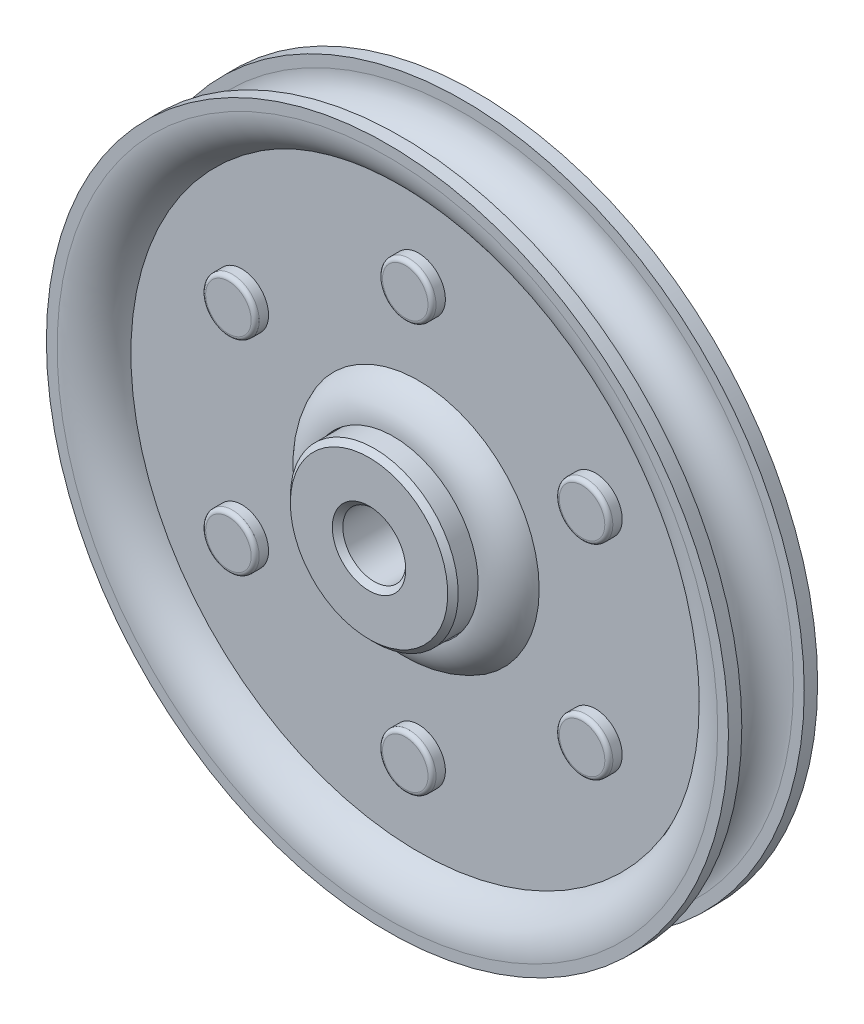
from build123d import *

# Parameters (mm, degrees)
CIRPATTERN1_COUNT = 20
CHAMFER1_SIZE     = 0.79375
FILLET1_R         = 0.60721875
CIRPATTERN2_COUNT = 6
CIRPATTERN3_COUNT = 6


with BuildPart() as part:
    # Sketch1 → Revolve1 (revolve)
    with BuildSketch(Plane(origin=(0, 0, 0), x_dir=(0, 0, -1), z_dir=(1, 0, 0))):
        with BuildLine():
            Line((4.7228125, 51.59375), (6.746875, 51.59375))
            Line((6.746875, 51.59375), (6.746875, 49.9665625))
            ThreePointArc((6.746875, 49.9665625), (5.439504525, 45.975057421), (2.0240625, 43.53045395))
            Line((2.0240625, 43.53045395), (2.0240625, 18.244026183))
            ThreePointArc((2.0240625, 18.244026183), (4.775434847, 16.12924186), (5.842, 12.827))
            Line((5.842, 12.827), (1.98335874, 12.827))
            ThreePointArc((1.98335874, 12.827), (0, 14.747875), (-1.98335874, 12.827))
            Line((-1.98335874, 12.827), (-5.842, 12.827))
            ThreePointArc((-5.842, 12.827), (-4.775434847, 16.12924186), (-2.0240625, 18.244026183))
            Line((-2.0240625, 18.244026183), (-2.0240625, 43.53045395))
            ThreePointArc((-2.0240625, 43.53045395), (-5.439504525, 45.975057421), (-6.746875, 49.9665625))
            Line((-6.746875, 49.9665625), (-6.746875, 51.59375))
            Line((-6.746875, 51.59375), (-4.7228125, 51.59375))
            Line((-4.7228125, 51.59375), (-4.7228125, 49.9665625))
            ThreePointArc((-4.7228125, 49.9665625), (0, 45.24375), (4.7228125, 49.9665625))
            Line((4.7228125, 49.9665625), (4.7228125, 51.59375))
        make_face()
        with BuildLine():
            Line((9.525, 4.7625), (-9.525, 4.7625))
            Line((-9.525, 4.7625), (-9.525, 12.7))
            Line((-9.525, 12.7), (-1.98335874, 12.7))
            ThreePointArc((-1.98335874, 12.7), (0, 10.779125), (1.98335874, 12.7))
            Line((1.98335874, 12.7), (9.525, 12.7))
            Line((9.525, 12.7), (9.525, 4.7625))
        make_face()
    revolve(axis=Axis((0, 0, 9.525), (0, 0, -1)))

    # Chamfer1
    chamfer1_edges = [part.edges().sort_by_distance(p)[0] for p in [
        (0, -4.7625, -9.525),
        (0, -12.7, -9.525),
        (0, -12.7, 9.525),
        (0, -4.7625, 9.525),
    ]]
    chamfer(chamfer1_edges, length=CHAMFER1_SIZE)

    # Sketch4 → Cut-Revolve2 (revolve, cut)
    with BuildSketch(Plane(origin=(0, 0, 0), x_dir=(0, 0, -1), z_dir=(1, 0, 0))):
        Polygon((-2.0240625, 32.911302567), (2.0240625, 32.911302567), (2.0240625, 34.935365067), (4.048125, 34.935365067), (4.048125, 30.887240067), (-4.048125, 30.887240067), (-4.048125, 34.935365067), (-2.0240625, 34.935365067), align=None)
    cut_revolve2 = revolve(axis=Axis((0, 30.887240067, 4.048125), (0, 0, -1)), mode=Mode.SUBTRACT)

    # CirPattern2: Cut-Revolve2 ×6 about axis
    cirpattern2_axis = Axis((0, 0, 0), (0, 0, -1))
    for i in range(1, CIRPATTERN2_COUNT):
        add(cut_revolve2.rotate(cirpattern2_axis, i * 360 / CIRPATTERN2_COUNT), mode=Mode.SUBTRACT)


with BuildPart() as body_2:
    # Sketch2 → Revolve2 (revolve)
    with BuildSketch(Plane(origin=(0, 0, 0), x_dir=(0, 0, -1), z_dir=(1, 0, 0))):
        with BuildLine():
            Line((0, 14.747875), (0, 10.779125))
            ThreePointArc((0, 10.779125), (1.984375, 12.7635), (0, 14.747875))
        make_face()
    revolve(axis=Axis((0, 14.747875, 0), (0, -1, 0)))


with BuildPart() as cirpattern1_1:
    # CirPattern1: pattern copy
    add(body_2.part.rotate(Axis((0, 0, 0), (0, 0, -1)), 1 * 360 / CIRPATTERN1_COUNT))


with BuildPart() as cirpattern1_2:
    # CirPattern1: pattern copy
    add(body_2.part.rotate(Axis((0, 0, 0), (0, 0, -1)), 2 * 360 / CIRPATTERN1_COUNT))


with BuildPart() as cirpattern1_3:
    # CirPattern1: pattern copy
    add(body_2.part.rotate(Axis((0, 0, 0), (0, 0, -1)), 3 * 360 / CIRPATTERN1_COUNT))


with BuildPart() as cirpattern1_4:
    # CirPattern1: pattern copy
    add(body_2.part.rotate(Axis((0, 0, 0), (0, 0, -1)), 4 * 360 / CIRPATTERN1_COUNT))


with BuildPart() as cirpattern1_5:
    # CirPattern1: pattern copy
    add(body_2.part.rotate(Axis((0, 0, 0), (0, 0, -1)), 5 * 360 / CIRPATTERN1_COUNT))


with BuildPart() as cirpattern1_6:
    # CirPattern1: pattern copy
    add(body_2.part.rotate(Axis((0, 0, 0), (0, 0, -1)), 6 * 360 / CIRPATTERN1_COUNT))


with BuildPart() as cirpattern1_7:
    # CirPattern1: pattern copy
    add(body_2.part.rotate(Axis((0, 0, 0), (0, 0, -1)), 7 * 360 / CIRPATTERN1_COUNT))


with BuildPart() as cirpattern1_8:
    # CirPattern1: pattern copy
    add(body_2.part.rotate(Axis((0, 0, 0), (0, 0, -1)), 8 * 360 / CIRPATTERN1_COUNT))


with BuildPart() as cirpattern1_9:
    # CirPattern1: pattern copy
    add(body_2.part.rotate(Axis((0, 0, 0), (0, 0, -1)), 9 * 360 / CIRPATTERN1_COUNT))


with BuildPart() as cirpattern1_10:
    # CirPattern1: pattern copy
    add(body_2.part.rotate(Axis((0, 0, 0), (0, 0, -1)), 10 * 360 / CIRPATTERN1_COUNT))


with BuildPart() as cirpattern1_11:
    # CirPattern1: pattern copy
    add(body_2.part.rotate(Axis((0, 0, 0), (0, 0, -1)), 11 * 360 / CIRPATTERN1_COUNT))


with BuildPart() as cirpattern1_12:
    # CirPattern1: pattern copy
    add(body_2.part.rotate(Axis((0, 0, 0), (0, 0, -1)), 12 * 360 / CIRPATTERN1_COUNT))


with BuildPart() as cirpattern1_13:
    # CirPattern1: pattern copy
    add(body_2.part.rotate(Axis((0, 0, 0), (0, 0, -1)), 13 * 360 / CIRPATTERN1_COUNT))


with BuildPart() as cirpattern1_14:
    # CirPattern1: pattern copy
    add(body_2.part.rotate(Axis((0, 0, 0), (0, 0, -1)), 14 * 360 / CIRPATTERN1_COUNT))


with BuildPart() as cirpattern1_15:
    # CirPattern1: pattern copy
    add(body_2.part.rotate(Axis((0, 0, 0), (0, 0, -1)), 15 * 360 / CIRPATTERN1_COUNT))


with BuildPart() as cirpattern1_16:
    # CirPattern1: pattern copy
    add(body_2.part.rotate(Axis((0, 0, 0), (0, 0, -1)), 16 * 360 / CIRPATTERN1_COUNT))


with BuildPart() as cirpattern1_17:
    # CirPattern1: pattern copy
    add(body_2.part.rotate(Axis((0, 0, 0), (0, 0, -1)), 17 * 360 / CIRPATTERN1_COUNT))


with BuildPart() as cirpattern1_18:
    # CirPattern1: pattern copy
    add(body_2.part.rotate(Axis((0, 0, 0), (0, 0, -1)), 18 * 360 / CIRPATTERN1_COUNT))


with BuildPart() as cirpattern1_19:
    # CirPattern1: pattern copy
    add(body_2.part.rotate(Axis((0, 0, 0), (0, 0, -1)), 19 * 360 / CIRPATTERN1_COUNT))


with BuildPart() as body_22:
    # Sketch4<2> → Revolve3 (revolve)
    with BuildSketch(Plane(origin=(0, 0, 0), x_dir=(0, 0, -1), z_dir=(1, 0, 0))):
        Polygon((-2.0240625, 32.911302567), (2.0240625, 32.911302567), (2.0240625, 34.935365067), (4.048125, 34.935365067), (4.048125, 30.887240067), (-4.048125, 30.887240067), (-4.048125, 34.935365067), (-2.0240625, 34.935365067), align=None)
    revolve(axis=Axis((0, 30.887240067, 4.048125), (0, 0, -1)))

    # Fillet1
    fillet1_edges = [body_22.edges().sort_by_distance(p)[0] for p in [
        (0, 26.839115067, -4.048125),
        (0, 26.839115067, 4.048125),
    ]]
    fillet(fillet1_edges, radius=FILLET1_R)


with BuildPart() as cirpattern3_1:
    # CirPattern3: pattern copy
    add(body_22.part.rotate(Axis((0, 0, 0), (0, 0, -1)), 1 * 360 / CIRPATTERN3_COUNT))


with BuildPart() as cirpattern3_2:
    # CirPattern3: pattern copy
    add(body_22.part.rotate(Axis((0, 0, 0), (0, 0, -1)), 2 * 360 / CIRPATTERN3_COUNT))


with BuildPart() as cirpattern3_3:
    # CirPattern3: pattern copy
    add(body_22.part.rotate(Axis((0, 0, 0), (0, 0, -1)), 3 * 360 / CIRPATTERN3_COUNT))


with BuildPart() as cirpattern3_4:
    # CirPattern3: pattern copy
    add(body_22.part.rotate(Axis((0, 0, 0), (0, 0, -1)), 4 * 360 / CIRPATTERN3_COUNT))


with BuildPart() as cirpattern3_5:
    # CirPattern3: pattern copy
    add(body_22.part.rotate(Axis((0, 0, 0), (0, 0, -1)), 5 * 360 / CIRPATTERN3_COUNT))


solid = Compound([part.part, body_2.part, cirpattern1_1.part, cirpattern1_2.part, cirpattern1_3.part, cirpattern1_4.part, cirpattern1_5.part, cirpattern1_6.part, cirpattern1_7.part, cirpattern1_8.part, cirpattern1_9.part, cirpattern1_10.part, cirpattern1_11.part, cirpattern1_12.part, cirpattern1_13.part, cirpattern1_14.part, cirpattern1_15.part, cirpattern1_16.part, cirpattern1_17.part, cirpattern1_18.part, cirpattern1_19.part, body_22.part, cirpattern3_1.part, cirpattern3_2.part, cirpattern3_3.part, cirpattern3_4.part, cirpattern3_5.part])
